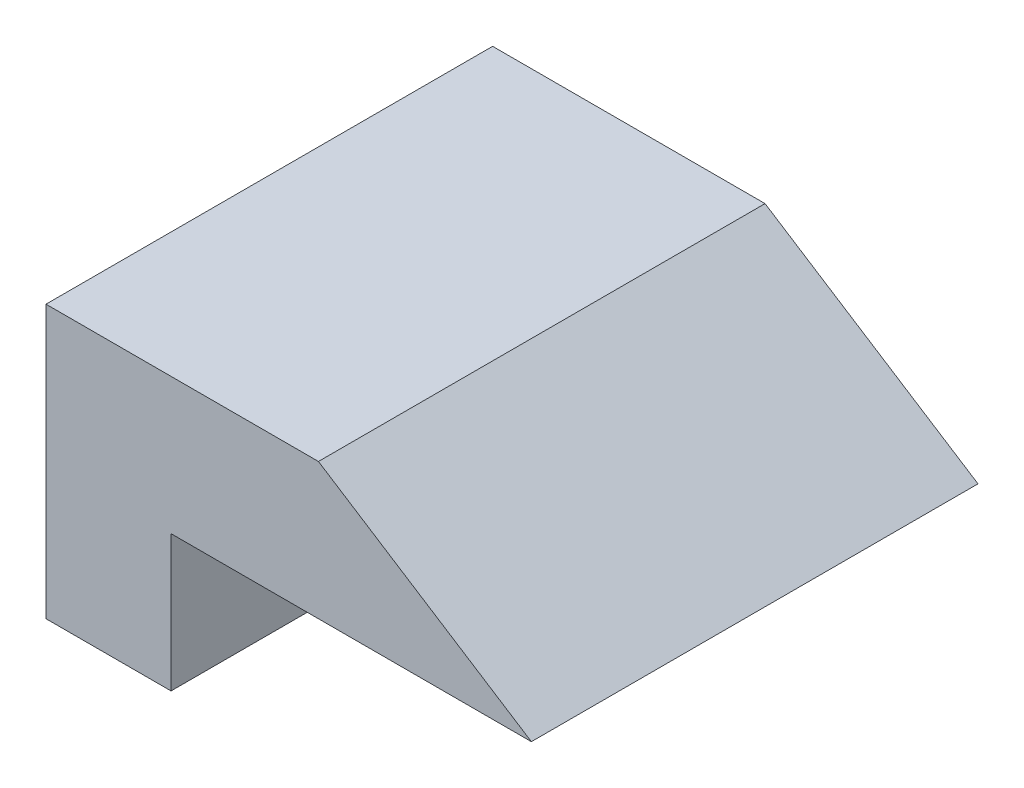
from build123d import *

# Parameters (mm, degrees)
SALIENTE_EXTRUIR1_DEPTH = 10


with BuildPart() as part:
    # Croquis1 → Saliente-Extruir1 (new body)
    with BuildSketch(Plane(origin=(0, 0, 0), x_dir=(0, 1, 0), z_dir=(0, 0, 1))):
        Polygon((3.05, 8.067721178), (0, 8.067721178), (0, 0), (3.05, 4.767721178), align=None)
        Polygon((-3.05, 10.867721178), (-3.05, 8.067721178), (0, 8.067721178), (3.05, 8.067721178), (3.05, 10.867721178), align=None)
    extrude(amount=SALIENTE_EXTRUIR1_DEPTH)


solid = part.part
